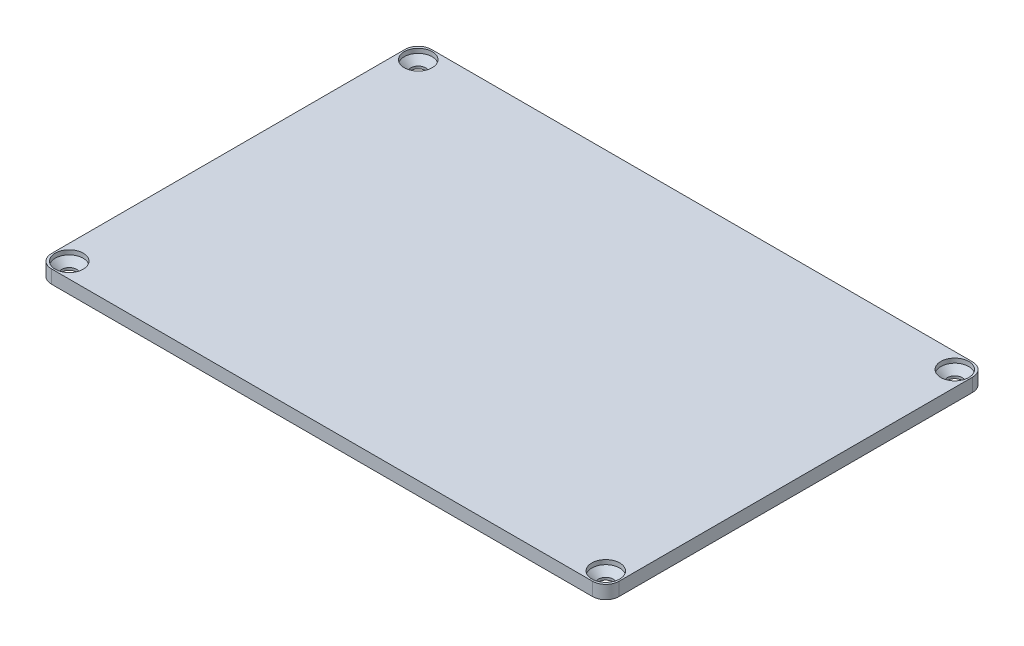
from build123d import *

# Parameters (mm, degrees)
SKETCH1_W                                      = 128
SKETCH1_H                                      = 85.7
BOSS_EXTRUDE1_DEPTH                            = 3
CSK_FOR_M3_FLAT_HEAD_MACHINE_SCREW1_AT_2_COUNT = 2
CSK_FOR_M3_FLAT_HEAD_MACHINE_SCREW1_AT_2_PITCH = 121
CSK_FOR_M3_FLAT_HEAD_MACHINE_SCREW1_AT_3_COUNT = 2
CSK_FOR_M3_FLAT_HEAD_MACHINE_SCREW1_AT_3_PITCH = 144.342266852
CSK_FOR_M3_FLAT_HEAD_MACHINE_SCREW1_AT_4_COUNT = 2
CSK_FOR_M3_FLAT_HEAD_MACHINE_SCREW1_AT_4_PITCH = 78.7
FILLET1_R                                      = 3


with BuildPart() as part:
    # Sketch1 → Boss-Extrude1 (new body)
    with BuildSketch(Plane(origin=(0, 0, 0), x_dir=(1, 0, 0), z_dir=(0, 1, 0))):
        Rectangle(SKETCH1_W, SKETCH1_H)
    extrude(amount=BOSS_EXTRUDE1_DEPTH)

    # Sketch3 → CSK for M3 Flat Head Machine Screw1 (revolve, cut)
    with BuildSketch(Plane(origin=(-60.5, 3, -39.35), x_dir=(0, 0, 1), z_dir=(1, 0, 0))):
        Polygon((0, 0), (0, 4.021463052), (1.7, 3), (1.7, 2.45), (3.15, 1), (3.15, 0), align=None)
    csk_for_m3_flat_head_machine_screw1 = revolve(axis=Axis((-60.5, 9.35, -39.35), (0, -1, 0)), mode=Mode.SUBTRACT)

    # CSK for M3 Flat Head Machine Screw1 at 2: CSK for M3 Flat Head Machine Screw1 ×2
    with Locations(*[(i * CSK_FOR_M3_FLAT_HEAD_MACHINE_SCREW1_AT_2_PITCH, 0, 0) for i in range(1, CSK_FOR_M3_FLAT_HEAD_MACHINE_SCREW1_AT_2_COUNT)]):
        add(csk_for_m3_flat_head_machine_screw1, mode=Mode.SUBTRACT)

    # CSK for M3 Flat Head Machine Screw1 at 3: CSK for M3 Flat Head Machine Screw1 ×2
    with Locations(*[Vector(0.8382852967384159, 0, 0.54523184176292) * (i * CSK_FOR_M3_FLAT_HEAD_MACHINE_SCREW1_AT_3_PITCH) for i in range(1, CSK_FOR_M3_FLAT_HEAD_MACHINE_SCREW1_AT_3_COUNT)]):
        add(csk_for_m3_flat_head_machine_screw1, mode=Mode.SUBTRACT)

    # CSK for M3 Flat Head Machine Screw1 at 4: CSK for M3 Flat Head Machine Screw1 ×2
    with Locations(*[(0, 0, i * CSK_FOR_M3_FLAT_HEAD_MACHINE_SCREW1_AT_4_PITCH) for i in range(1, CSK_FOR_M3_FLAT_HEAD_MACHINE_SCREW1_AT_4_COUNT)]):
        add(csk_for_m3_flat_head_machine_screw1, mode=Mode.SUBTRACT)

    # Fillet1
    fillet1_edges = [part.edges().sort_by_distance(p)[0] for p in [
        (64, 1.5, 42.85),
        (-64, 1.5, 42.85),
        (-64, 1.5, -42.85),
        (64, 1.5, -42.85),
    ]]
    fillet(fillet1_edges, radius=FILLET1_R)


solid = part.part
